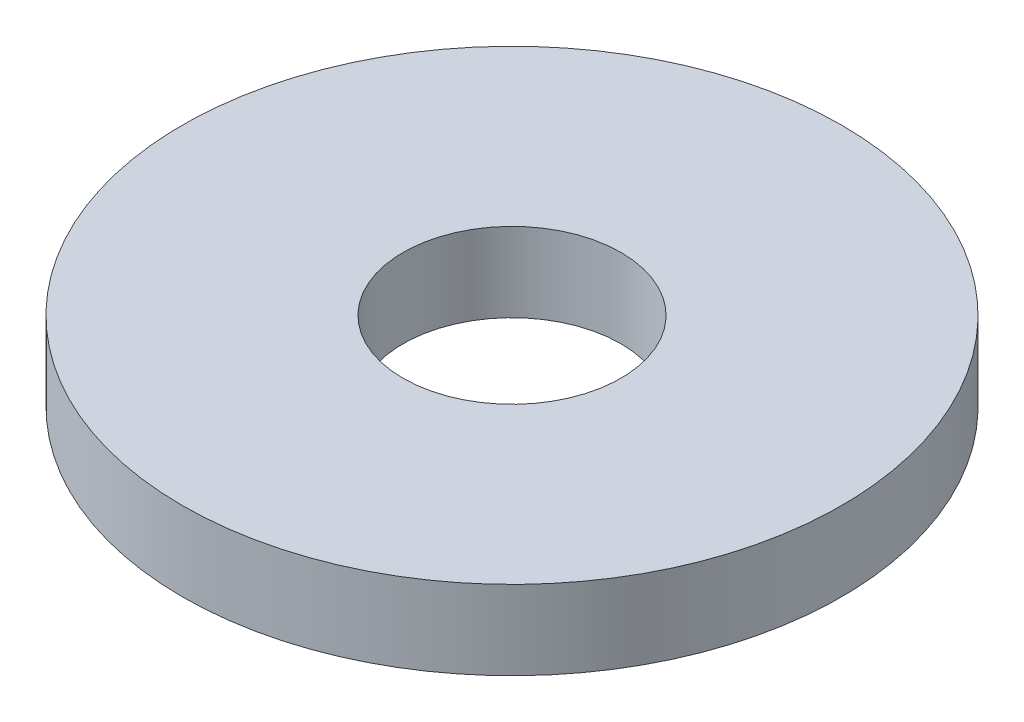
from build123d import *

# Parameters (mm, degrees)
SKETCH1_R           = 4.7625
BOSS_EXTRUDE1_DEPTH = 1.143
SKETCH5_R           = 1.5748
CUT_EXTRUDE1_DEPTH  = 7.83149043


with BuildPart() as part:
    # Sketch1 → Boss-Extrude1 (new body)
    with BuildSketch(Plane(origin=(0, 0, 0), x_dir=(1, 0, 0), z_dir=(0, 1, 0))):
        with Locations(Location((0, 0, 0), (0, 0, 270))):
            Circle(SKETCH1_R)
    extrude(amount=BOSS_EXTRUDE1_DEPTH)

    # Sketch5 → Cut-Extrude1 (cut, through all)
    with BuildSketch(Plane(origin=(0, 1.143, 0), x_dir=(-1, 0, 0), z_dir=(0, 1, 0))):
        with Locations(Location((0, 0, 0), (0, 0, 90))):
            Circle(SKETCH5_R)
    extrude(amount=-CUT_EXTRUDE1_DEPTH, mode=Mode.SUBTRACT)


solid = part.part
